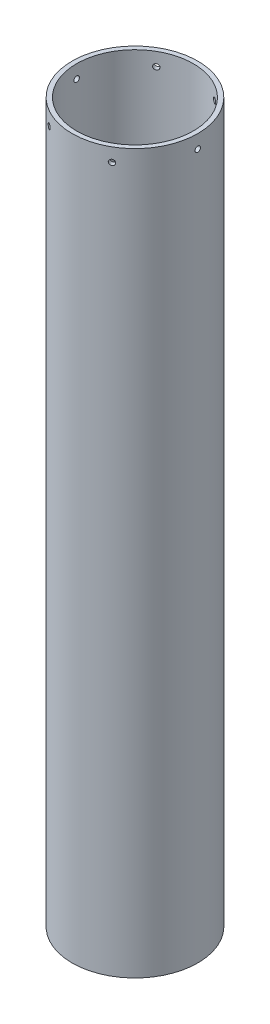
from build123d import *

# Parameters (mm, degrees)
SKETCH1_R               = 70
SKETCH1_R_2             = 65
BOSS_EXTRUDE1_DEPTH     = 800
CUT_EXTRUDE1_REACH      = 808.102
CUT_EXTRUDE1_END_RADIUS = 70
SKETCH2_R               = 3.05
CIRPATTERN1_COUNT       = 6


with BuildPart() as part:
    # Sketch1 → Boss-Extrude1 (new body)
    with BuildSketch(Plane(origin=(0, 0, 0), x_dir=(1, 0, 0), z_dir=(0, 1, 0))):
        with Locations(Location((0, 0, 0), (0, 0, 270))):
            Circle(SKETCH1_R)
        with Locations(Location((0, 0, 0), (0, 0, 270))):
            Circle(SKETCH1_R_2, mode=Mode.SUBTRACT)
    extrude(amount=BOSS_EXTRUDE1_DEPTH)

    # Cut-Extrude1: up to this cylinder (the profile starts inside it)
    cut_extrude1_end = Plane(origin=(0, 785, 0), z_dir=(0, -1, 0)) * Cylinder(CUT_EXTRUDE1_END_RADIUS, 1757.204, mode=Mode.PRIVATE)
    # Sketch2 → Cut-Extrude1 (cut, up to the surface)
    with BuildSketch(Plane(origin=(0, 0, 0), x_dir=(0, 0, -1), z_dir=(1, 0, 0)), mode=Mode.PRIVATE) as cut_extrude1_sk1:
        with Locations((0, 785)):
            Circle(SKETCH2_R)
    cut_extrude1_tool1 = extrude(cut_extrude1_sk1.sketch, amount=-CUT_EXTRUDE1_REACH, mode=Mode.PRIVATE) & cut_extrude1_end
    cut_extrude1 = cut_extrude1_tool1.solids().sort_by_distance((0, 785, 0))[0]
    add(cut_extrude1, mode=Mode.SUBTRACT)

    # CirPattern1: Cut-Extrude1 ×6 about axis
    cirpattern1_axis = Axis((0, 800, 0), (0, 1, 0))
    for i in range(1, CIRPATTERN1_COUNT):
        add(cut_extrude1.rotate(cirpattern1_axis, i * 360 / CIRPATTERN1_COUNT), mode=Mode.SUBTRACT)


solid = part.part
